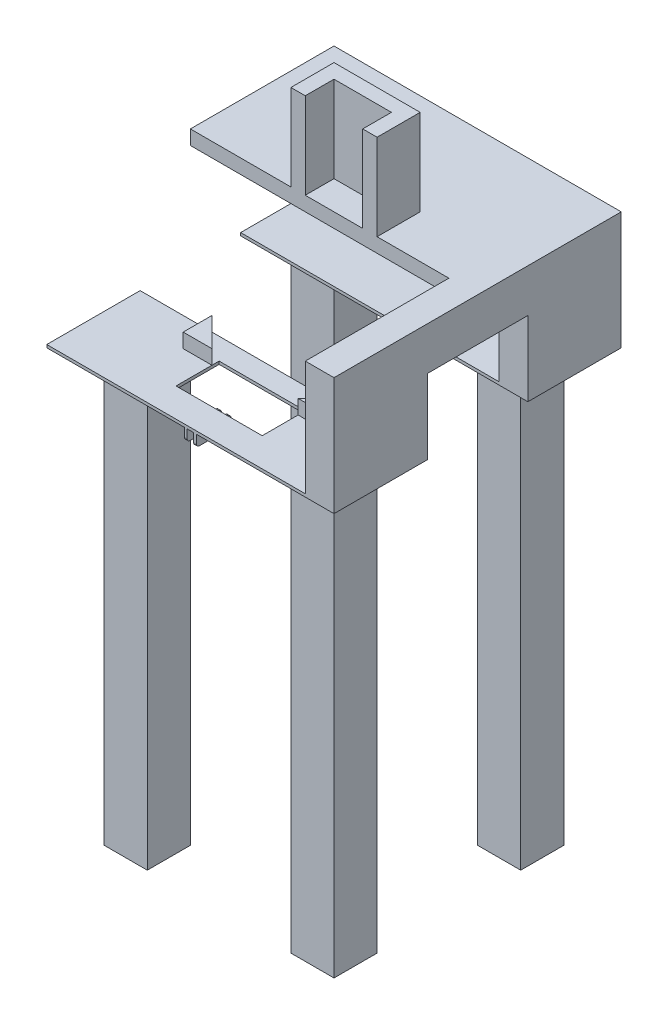
from build123d import *

# Parameters (mm, degrees)
SKETCH1_W           = 1000
SKETCH1_H           = 1000
BOSS_EXTRUDE1_DEPTH = 10
SKETCH5_W           = 150
SKETCH5_H           = 150
BOSS_EXTRUDE2_DEPTH = 1500
SKETCH7_W           = 300
SKETCH7_H           = 150
CUT_EXTRUDE1_DEPTH  = 1500
SKETCH9_W           = 10
SKETCH9_H           = 120
BOSS_EXTRUDE4_DEPTH = 40
FILLET1_R           = 10
FILLET2_R           = 10
SKETCH10_R          = 5
CUT_EXTRUDE3_DEPTH  = 55
SKETCH11_W          = 100
SKETCH11_H          = 1000
BOSS_EXTRUDE5_DEPTH = 400
SKETCH12_W          = 500
SKETCH12_H          = 50
BOSS_EXTRUDE6_DEPTH = 900
SKETCH14_W          = 300
SKETCH14_H          = 150
BOSS_EXTRUDE7_DEPTH = 300
SKETCH15_W          = 200
SKETCH15_H          = 100
CUT_EXTRUDE4_DEPTH  = 300
SKETCH8_W           = 1000
SKETCH8_H           = 350
CUT_EXTRUDE2_DEPTH  = 2069.840254829
SKETCH16_W          = 350
SKETCH16_H          = 250
CUT_EXTRUDE5_DEPTH  = 2062.552812809
BOSS_EXTRUDE8_DEPTH = 50
SKETCH21_R          = 7.5
CUT_EXTRUDE7_DEPTH  = 50
SKETCH22_R          = 7.5
CUT_EXTRUDE8_DEPTH  = 50


with BuildPart() as part:
    # Sketch1 → Boss-Extrude1 (new body)
    with BuildSketch(Plane(origin=(0, 0, 0), x_dir=(1, 0, 0), z_dir=(0, 1, 0))):
        with Locations((-500, 500)):
            Rectangle(SKETCH1_W, SKETCH1_H)
    extrude(amount=BOSS_EXTRUDE1_DEPTH)

    # Sketch5 → Boss-Extrude2 (add)
    with BuildSketch(Plane.XZ):
        with Locations((-825, -825)):
            Rectangle(SKETCH5_W, SKETCH5_H)
        with Locations((-825, -175)):
            Rectangle(SKETCH5_W, SKETCH5_H)
        with Locations((-175, -825)):
            Rectangle(SKETCH5_W, SKETCH5_H)
        with Locations((-175, -175)):
            Rectangle(SKETCH5_W, SKETCH5_H)
    extrude(amount=BOSS_EXTRUDE2_DEPTH)

    # Sketch7 → Cut-Extrude1 (cut)
    with BuildSketch(Plane(origin=(0, 10, 0), x_dir=(1, 0, 0), z_dir=(0, 1, 0))):
        with Locations((-500, 175)):
            Rectangle(SKETCH7_W, SKETCH7_H)
    extrude(amount=-CUT_EXTRUDE1_DEPTH, mode=Mode.SUBTRACT)

    # Sketch9 → Boss-Extrude4 (add)
    with BuildSketch(Plane.XZ):
        with Locations((-516, -60)):
            Rectangle(SKETCH9_W, SKETCH9_H)
        with Locations((-484, -60)):
            Rectangle(SKETCH9_W, SKETCH9_H)
    extrude(amount=BOSS_EXTRUDE4_DEPTH)

    # Fillet1
    fillet1_edges = [part.edges().sort_by_distance(p)[0] for p in [
        (-516, 0, -120),
        (-516, -40, -120),
        (-484, 0, -120),
        (-484, -40, -120),
    ]]
    fillet(fillet1_edges, radius=FILLET1_R)

    # Fillet2
    fillet2_edges = [part.edges().sort_by_distance(p)[0] for p in [
        (-516, -40, 0),
        (-484, -40, 0),
    ]]
    fillet(fillet2_edges, radius=FILLET2_R)

    # Sketch10 → Cut-Extrude3 (cut)
    with BuildSketch(Plane.ZY.offset(521)):
        with Locations((-110.273760932, -30.192862472)):
            Circle(SKETCH10_R)
    extrude(amount=-CUT_EXTRUDE3_DEPTH, mode=Mode.SUBTRACT)

    # Sketch11 → Boss-Extrude5 (add)
    with BuildSketch(Plane(origin=(0, 10, 0), x_dir=(1, 0, 0), z_dir=(0, 1, 0))):
        with Locations((-50, 500)):
            Rectangle(SKETCH11_W, SKETCH11_H)
    extrude(amount=BOSS_EXTRUDE5_DEPTH)

    # Sketch12 → Boss-Extrude6 (add)
    with BuildSketch(Plane.ZY.offset(100)):
        with Locations((-750, 385)):
            Rectangle(SKETCH12_W, SKETCH12_H)
    extrude(amount=BOSS_EXTRUDE6_DEPTH)

    # Sketch14 → Boss-Extrude7 (add)
    with BuildSketch(Plane(origin=(0, 410, 0), x_dir=(1, 0, 0), z_dir=(0, 1, 0))):
        with Locations((-500, 575)):
            Rectangle(SKETCH14_W, SKETCH14_H)
    extrude(amount=BOSS_EXTRUDE7_DEPTH)

    # Sketch15 → Cut-Extrude4 (cut)
    with BuildSketch(Plane(origin=(0, 710, 0), x_dir=(1, 0, 0), z_dir=(0, 1, 0))):
        with Locations((-500, 550)):
            Rectangle(SKETCH15_W, SKETCH15_H)
    extrude(amount=-CUT_EXTRUDE4_DEPTH, mode=Mode.SUBTRACT)

    # Sketch8 → Cut-Extrude2 (cut, through all)
    with BuildSketch(Plane(origin=(0, 10, 0), x_dir=(1, 0, 0), z_dir=(0, 1, 0))):
        with Locations((-500, 500)):
            Rectangle(SKETCH8_W, SKETCH8_H)
    extrude(amount=-CUT_EXTRUDE2_DEPTH, mode=Mode.SUBTRACT)

    # Sketch16 → Cut-Extrude5 (cut, through all)
    with BuildSketch(Plane(origin=(0, 0, 0), x_dir=(0, 0, -1), z_dir=(1, 0, 0))):
        with Locations((500, 135)):
            Rectangle(SKETCH16_W, SKETCH16_H)
    extrude(amount=-CUT_EXTRUDE5_DEPTH, mode=Mode.SUBTRACT)

    # Sketch18 → Boss-Extrude8 (add)
    with BuildSketch(Plane(origin=(0, 10, 0), x_dir=(1, 0, 0), z_dir=(0, 1, 0))):
        Polygon((-750, 325), (-750, 225), (-650, 225), align=None)
        Polygon((-350, 225), (-250, 225), (-250, 325), align=None)
    extrude(amount=BOSS_EXTRUDE8_DEPTH)

    # Sketch21 → Cut-Extrude7 (cut)
    with BuildSketch(Plane(origin=(-287.5, 0, -287.5), x_dir=(-0.7071067811865475, 0, 0.7071067811865477), z_dir=(-0.7071067811865477, 0, -0.7071067811865475))):
        with Locations((17.888347648, 45)):
            Circle(SKETCH21_R)
        with Locations((17.888347648, 25)):
            Circle(SKETCH21_R)
    extrude(amount=-CUT_EXTRUDE7_DEPTH, mode=Mode.SUBTRACT)

    # Sketch22 → Cut-Extrude8 (cut)
    with BuildSketch(Plane(origin=(-212.5, 0, 212.5), x_dir=(-0.7071067811865474, 0, -0.7071067811865477), z_dir=(0.7071067811865477, 0, -0.7071067811865474))):
        with Locations((689.218433538, 45)):
            Circle(SKETCH22_R)
        with Locations((689.218433538, 25)):
            Circle(SKETCH22_R)
    extrude(amount=-CUT_EXTRUDE8_DEPTH, mode=Mode.SUBTRACT)


solid = part.part
